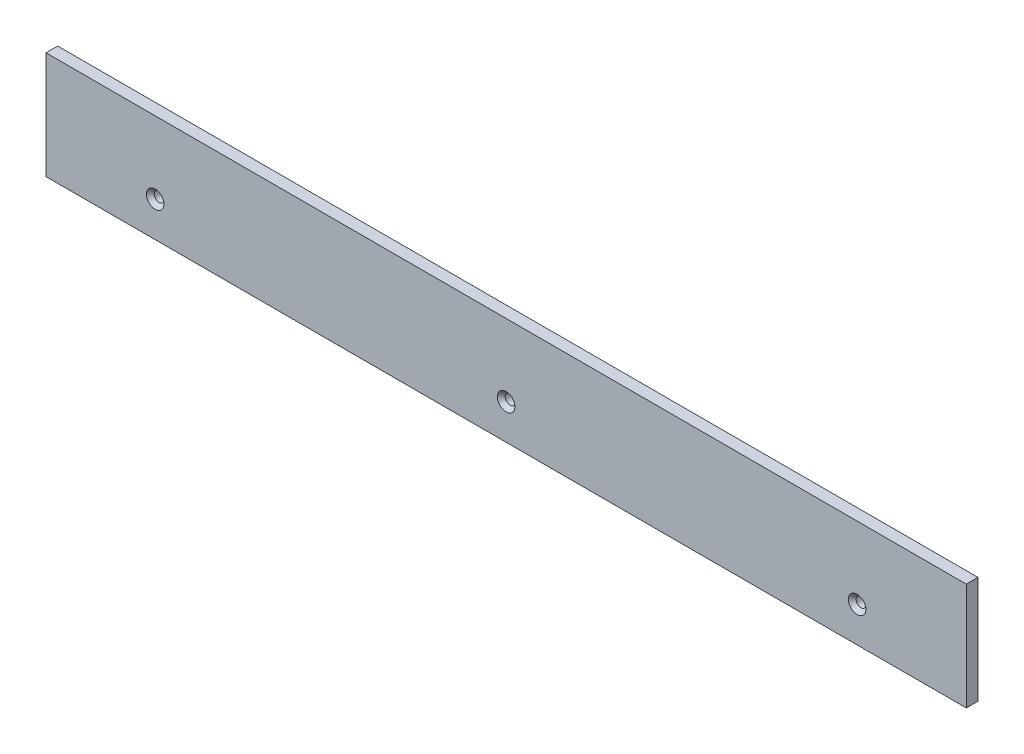
from build123d import *

# Parameters (mm, degrees)
ESQUISSE1_W             = 472
ESQUISSE1_H             = 55
BOSS_EXTRU_1_DEPTH      = 6
ESQUISSE6_R             = 2.5
ENL_V_MAT_EXTRU_1_DEPTH = 238.672568884
CHANFREIN1_SIZE         = 2


with BuildPart() as part:
    # Esquisse1 → Boss.-Extru.1 (new body)
    with BuildSketch(Plane.XY):
        Rectangle(ESQUISSE1_W, ESQUISSE1_H)
    extrude(amount=BOSS_EXTRU_1_DEPTH)

    # Esquisse6 → Enlèv. mat.-Extru.1 (cut, through all)
    with BuildSketch(Plane.XY.offset(6)):
        with Locations((-180, -9.5)):
            Circle(ESQUISSE6_R)
        with Locations((0, -9.5)):
            Circle(ESQUISSE6_R)
        with Locations((180, -9.5)):
            Circle(ESQUISSE6_R)
    extrude(amount=-ENL_V_MAT_EXTRU_1_DEPTH, mode=Mode.SUBTRACT)

    # Chanfrein1
    chanfrein1_edges = [part.edges().sort_by_distance(p)[0] for p in [
        (-182.5, -9.5, 6),
        (-2.5, -9.5, 6),
        (177.5, -9.5, 6),
    ]]
    chamfer(chanfrein1_edges, length=CHANFREIN1_SIZE)


solid = part.part
